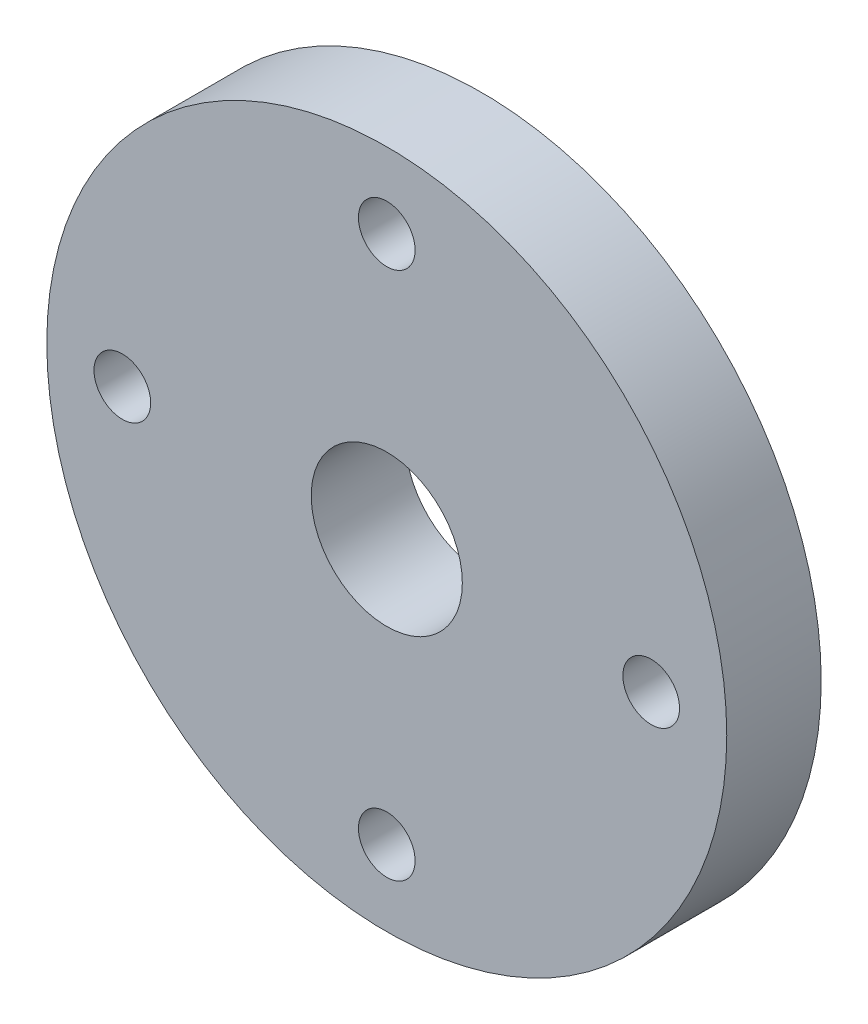
from build123d import *

# Parameters (mm, degrees)
SKETCH2_R           = 18
BOSS_EXTRUDE1_DEPTH = 5
SKETCH3_R           = 4
CUT_EXTRUDE1_DEPTH  = 122
SKETCH4_R           = 1.5
CUT_EXTRUDE2_DEPTH  = 5


with BuildPart() as part:
    # Sketch2 → Boss-Extrude1 (new body)
    with BuildSketch(Plane.XY):
        Circle(SKETCH2_R)
    extrude(amount=BOSS_EXTRUDE1_DEPTH)

    # Sketch3 → Cut-Extrude1 (cut)
    with BuildSketch(Plane.XY.offset(5)):
        Circle(SKETCH3_R)
    extrude(amount=-CUT_EXTRUDE1_DEPTH, mode=Mode.SUBTRACT)

    # Sketch4 → Cut-Extrude2 (cut)
    with BuildSketch(Plane(origin=(0, 0, 0), x_dir=(-1, 0, 0), z_dir=(0, 0, -1))):
        with Locations((0, 14)):
            Circle(SKETCH4_R)
        with Locations((14, 0)):
            Circle(SKETCH4_R)
        with Locations((0, -14)):
            Circle(SKETCH4_R)
        with Locations((-14, 0)):
            Circle(SKETCH4_R)
    extrude(amount=-CUT_EXTRUDE2_DEPTH, mode=Mode.SUBTRACT)


solid = part.part
